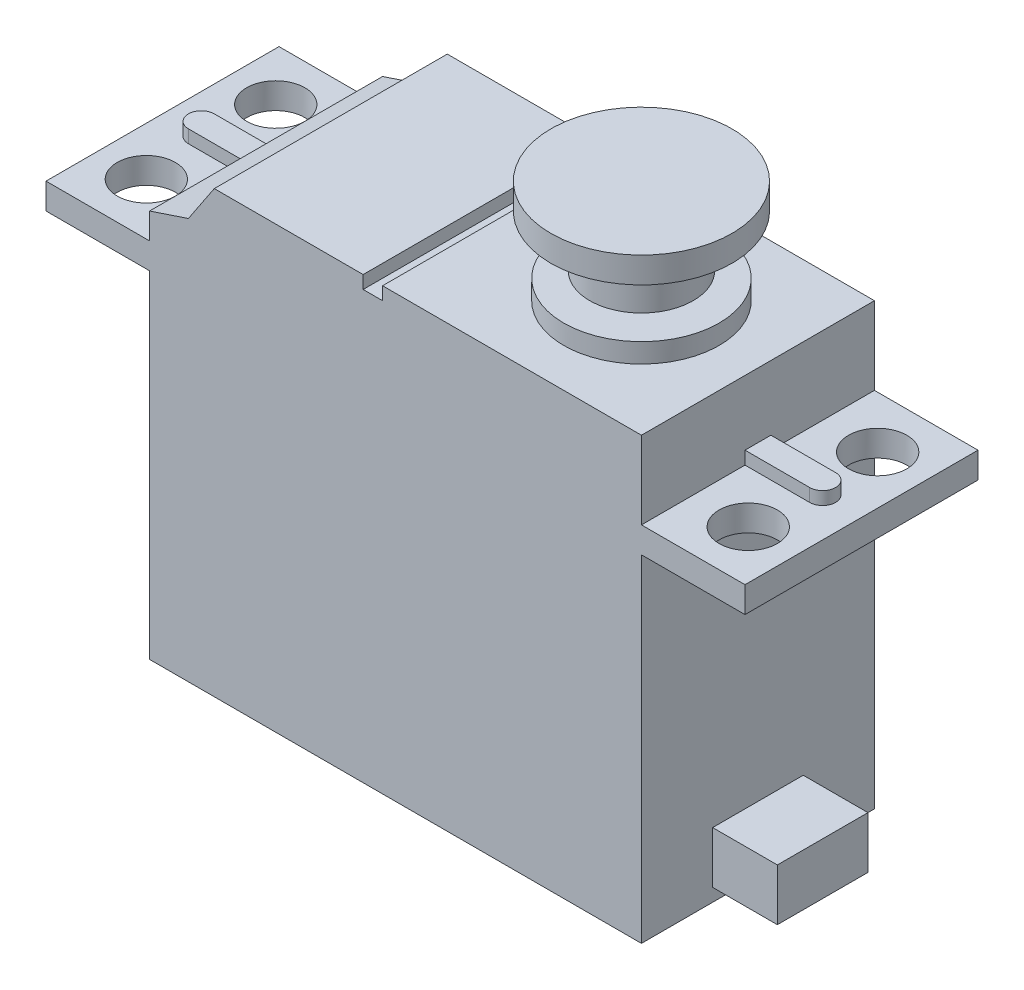
from build123d import *

# Parameters (mm, degrees)
SKETCH1_W                                  = 38
SKETCH1_H                                  = 18
BOSS_EXTRUDE1_DEPTH                        = 34
BOSS_EXTRUDE2_START                        = -6
SKETCH2_W                                  = 54
SKETCH2_H                                  = 18
BOSS_EXTRUDE2_DEPTH                        = 2
CUT_EXTRUDE1_DEPTH                         = 48
CUT_EXTRUDE1_DEPTH_BACK                    = 48
SKETCH3_W                                  = 1.5
SKETCH3_H                                  = 1
SKETCH4_R                                  = 6
BOSS_EXTRUDE3_DEPTH                        = 1.5
SKETCH5_W                                  = 6
SKETCH5_H                                  = 2
BOSS_EXTRUDE4_DEPTH                        = 1
FILLET1_RADIUS                             = 1
FILLET1_LENGTH                             = 1
FILLET1_OF_MIRROR1_2_RADIUS                = 1
FILLET1_OF_MIRROR1_2_LENGTH                = 1
SKETCH6_W                                  = 7
SKETCH6_H                                  = 4
BOSS_EXTRUDE5_DEPTH                        = 5
SKETCH7_R                                  = 3
BOSS_EXTRUDE6_DEPTH                        = 4
BOSS_EXTRUDE7_START                        = 8
SKETCH8_R                                  = 7
BOSS_EXTRUDE7_DEPTH                        = 2
SKETCH9_R                                  = 4
BOSS_EXTRUDE8_DEPTH                        = 4
SKETCH10_R                                 = 2.25
CUT_EXTRUDE2_DEPTH                         = 4
MIRROR2_AT_THE_SECOND_PLANE_COPY_1_SKETC_R = 2.25
MIRROR2_AT_THE_SECOND_PLANE_COPY_1_DEPTH   = 4


with BuildPart() as part:
    # Sketch1 → Boss-Extrude1 (new body)
    with BuildSketch(Plane(origin=(0, 0, 0), x_dir=(1, 0, 0), z_dir=(0, 1, 0))):
        Rectangle(SKETCH1_W, SKETCH1_H)
    extrude(amount=BOSS_EXTRUDE1_DEPTH)

    # Sketch2 → Boss-Extrude2 (add)
    with BuildSketch(Plane(origin=(0, 34, 0), x_dir=(1, 0, 0), z_dir=(0, 1, 0)).offset(BOSS_EXTRUDE2_START)):
        Rectangle(SKETCH2_W, SKETCH2_H)
    extrude(amount=-BOSS_EXTRUDE2_DEPTH)

    # Sketch3 → Cut-Extrude1 (cut, two sides: drawn at the far end of the back side and taken through both)
    with BuildSketch(Plane.XY.offset(9).offset(-CUT_EXTRUDE1_DEPTH_BACK)):
        Polygon((-19, 30), (-16, 31), (-14, 34), (-19, 34), align=None)
        with Locations((-1.75, 33.5)):
            Rectangle(SKETCH3_W, SKETCH3_H)
    extrude(amount=CUT_EXTRUDE1_DEPTH + CUT_EXTRUDE1_DEPTH_BACK, mode=Mode.SUBTRACT)

    # Sketch4 → Boss-Extrude3 (add)
    with BuildSketch(Plane(origin=(0, 34, 0), x_dir=(1, 0, 0), z_dir=(0, 1, 0))):
        with Locations(Location((10, 0, 0), (0, 0, 90))):
            Circle(SKETCH4_R)
    extrude(amount=BOSS_EXTRUDE3_DEPTH)

    # Sketch5 → Boss-Extrude4 (add)
    with BuildSketch(Plane(origin=(0, 28, 0), x_dir=(1, 0, 0), z_dir=(0, 1, 0))):
        with Locations((-22, 0)):
            Rectangle(SKETCH5_W, SKETCH5_H)
    boss_extrude4 = extrude(amount=BOSS_EXTRUDE4_DEPTH)

    # Fillet1: full round fillet: the end face becomes a half cylinder, R = half its width
    fillet1_face = Plane((-25, 28.5, 0), x_dir=(0, -1, 0), z_dir=(-1, 0, 0))  # on the end face: x along it, z out of the body
    fillet1_slab = fillet1_face.offset(-FILLET1_RADIUS / 2) * Box(FILLET1_LENGTH, 2 * FILLET1_RADIUS, FILLET1_RADIUS, mode=Mode.PRIVATE)  # the body's end, R deep
    fillet1_round = Plane((-24, 28.5, 0), x_dir=(-1, 0, 0), z_dir=(0, -1, 0)) * Cylinder(FILLET1_RADIUS, FILLET1_LENGTH, mode=Mode.PRIVATE)  # its axis R under the face
    add(fillet1_slab - fillet1_round, mode=Mode.SUBTRACT)

    # Mirror1: Boss-Extrude4 across plane
    add(boss_extrude4.mirror(Plane(origin=(0, 0, 0), x_dir=(0, 0, 1), z_dir=(1, 0, 0))))

    # Fillet1 of Mirror1 2: full round fillet: the end face becomes a half cylinder, R = half its width
    fillet1_of_mirror1_2_face = Plane((25, 28.5, 0), x_dir=(0, -1, 0), z_dir=(1, 0, 0))  # on the end face: x along it, z out of the body
    fillet1_of_mirror1_2_slab = fillet1_of_mirror1_2_face.offset(-FILLET1_OF_MIRROR1_2_RADIUS / 2) * Box(FILLET1_OF_MIRROR1_2_LENGTH, 2 * FILLET1_OF_MIRROR1_2_RADIUS, FILLET1_OF_MIRROR1_2_RADIUS, mode=Mode.PRIVATE)  # the body's end, R deep
    fillet1_of_mirror1_2_round = Plane((24, 28.5, 0), x_dir=(1, 0, 0), z_dir=(0, -1, 0)) * Cylinder(FILLET1_OF_MIRROR1_2_RADIUS, FILLET1_OF_MIRROR1_2_LENGTH, mode=Mode.PRIVATE)  # its axis R under the face
    add(fillet1_of_mirror1_2_slab - fillet1_of_mirror1_2_round, mode=Mode.SUBTRACT)

    # Sketch6 → Boss-Extrude5 (add)
    with BuildSketch(Plane(origin=(19, 0, 0), x_dir=(0, 0, -1), z_dir=(1, 0, 0))):
        with Locations((0, 3)):
            Rectangle(SKETCH6_W, SKETCH6_H)
    extrude(amount=BOSS_EXTRUDE5_DEPTH)

    # Sketch7 → Boss-Extrude6 (add)
    with BuildSketch(Plane(origin=(0, 35.5, 0), x_dir=(1, 0, 0), z_dir=(0, 1, 0))):
        with Locations(Location((10, 0, 0), (0, 0, 270))):
            Circle(SKETCH7_R)
    extrude(amount=BOSS_EXTRUDE6_DEPTH)



with BuildPart() as body_2:
    # Sketch8 → Boss-Extrude7 (new body)
    with BuildSketch(Plane(origin=(0, 34, 0), x_dir=(1, 0, 0), z_dir=(0, 1, 0)).offset(BOSS_EXTRUDE7_START)):
        with Locations(Location((10, 0, 0), (0, 0, 270))):
            Circle(SKETCH8_R)
    extrude(amount=-BOSS_EXTRUDE7_DEPTH)


with BuildPart() as part_1:
    add(part.part)

    add(body_2.part)  # Boss-Extrude8 merges body 2
    # Sketch9 → Boss-Extrude8 (add)
    with BuildSketch(Plane.XZ.offset(-40)):
        with Locations(Location((10, 0, 0), (0, 0, 270))):
            Circle(SKETCH9_R)
    extrude(amount=BOSS_EXTRUDE8_DEPTH)

    # Sketch10 → Cut-Extrude2 (cut)
    with BuildSketch(Plane(origin=(0, 28, 0), x_dir=(1, 0, 0), z_dir=(0, 1, 0))):
        with Locations(Location((-23.25, 5, 0), (0, 0, 270))):
            Circle(SKETCH10_R)
    cut_extrude2 = extrude(amount=-CUT_EXTRUDE2_DEPTH, mode=Mode.SUBTRACT)

    # Mirror2: Cut-Extrude2 across plane
    add(cut_extrude2.mirror(Plane.XY), mode=Mode.SUBTRACT)

    # Mirror2 at the second plane: Cut-Extrude2 across plane
    add(cut_extrude2.mirror(Plane(origin=(0, 0, 0), x_dir=(0, 0, 1), z_dir=(1, 0, 0))), mode=Mode.SUBTRACT)

    # Mirror2 at the second plane copy 1 sketc → Mirror2 at the second plane copy 1 (cut)
    with BuildSketch(Plane(origin=(0, 28, 0), x_dir=(-1, 0, 0), z_dir=(0, 1, 0))):
        with Locations(Location((-23.25, 5, 0), (0, 0, 270))):
            Circle(MIRROR2_AT_THE_SECOND_PLANE_COPY_1_SKETC_R)
    extrude(amount=-MIRROR2_AT_THE_SECOND_PLANE_COPY_1_DEPTH, mode=Mode.SUBTRACT)


solid = part_1.part
